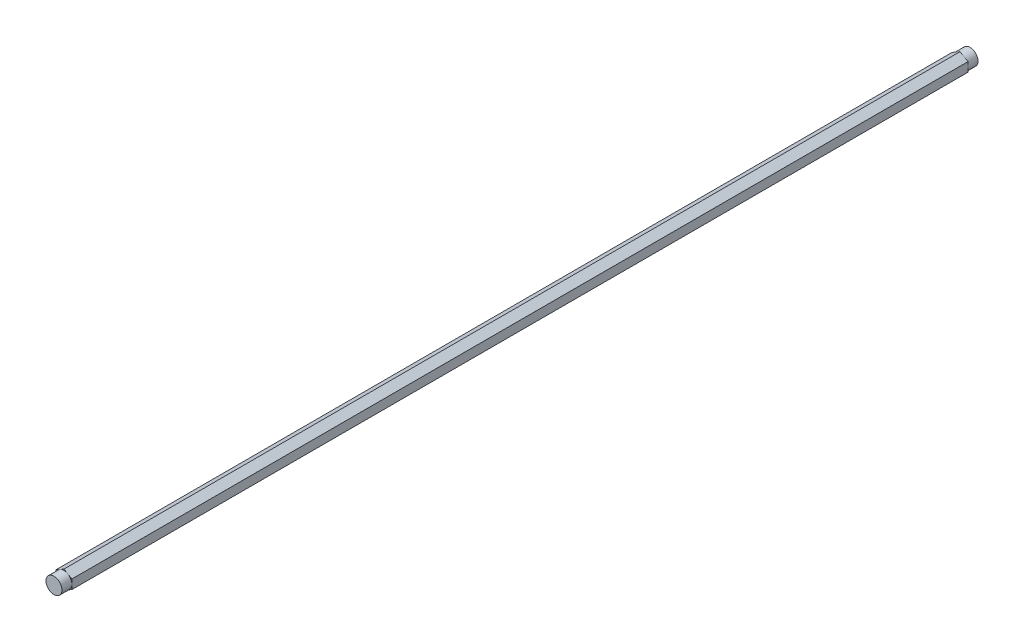
from build123d import *

# Parameters (mm, degrees)
BOSS_EXTRUDE1_DEPTH = 365.0361
SKETCH2_OUTSIDE_W   = 160.766
SKETCH2_OUTSIDE_H   = 162.73
SKETCH2_OUTSIDE_R   = 6.35
CUT_EXTRUDE1_DEPTH  = 7.9502


with BuildPart() as part:
    # Sketch1 → Boss-Extrude1 (new, symmetric)
    with BuildSketch(Plane.XY):
        Polygon((6.35, 3.666174209), (0, 7.332348419), (-6.35, 3.666174209), (-6.35, -3.666174209), (0, -7.332348419), (6.35, -3.666174209), align=None)
    extrude(amount=BOSS_EXTRUDE1_DEPTH, both=True)

    # Sketch2 outside → Cut-Extrude1 (cut)
    with BuildSketch(Plane.XY.offset(365.0361)):
        Rectangle(SKETCH2_OUTSIDE_W, SKETCH2_OUTSIDE_H)
        Circle(SKETCH2_OUTSIDE_R, mode=Mode.SUBTRACT)
    cut_extrude1 = extrude(amount=-CUT_EXTRUDE1_DEPTH, mode=Mode.SUBTRACT)

    # Mirror1: Cut-Extrude1 across plane
    add(cut_extrude1.mirror(Plane.XY), mode=Mode.SUBTRACT)


solid = part.part
